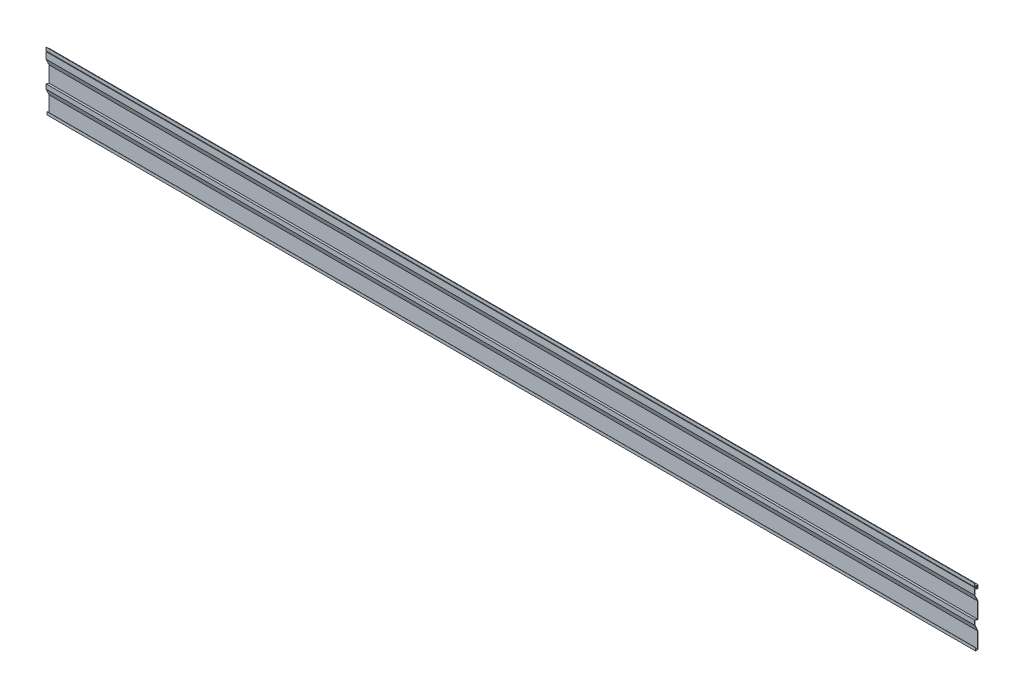
from build123d import *

# Parameters (mm, degrees)
EXTRUDE_1_DEPTH = 3660


with BuildPart() as part:
    # Эскиз1 → Бобышка-Вытянуть1 (new body)
    with BuildSketch(Plane(origin=(0, 0, 0), x_dir=(0, 0, -1), z_dir=(1, 0, 0))):
        Polygon((-21.04046283, -176.74277017), (-11.04046283, -176.74277017), (-11.04046283, -112.74277017), (-23.447393592, -86.746885797), (-23.447393592, -71.14960141), (-11.04046283, -74.694438771), (-11.04046283, -10.694438771), (-23.447393592, 15.301445602), (-23.447393592, 40.305561229), (-17.243928211, 40.305561229), (-17.243928211, 32.005165785), (-11.04046283, 32.005165785), (-11.04046283, 45.121064019), (-23.447393592, 45.121064019), (-23.447393592, 56.305561229), (-24.507119661, 56.305561229), (-24.507119661, 43.820437884), (-12.100188898, 43.820437884), (-12.100188898, 33.361087922), (-16.2229249, 33.361087922), (-16.2229249, 41.232557481), (-24.507119661, 41.232557481), (-24.507119661, 15.301445602), (-12.100188898, -10.694438771), (-12.100188898, -72.620716315), (-24.507119661, -69.075878954), (-24.507119661, -86.746885797), (-12.100188898, -112.74277017), (-12.100188898, -175.263961293), (-20.345660902, -175.263961293), (-20.345660902, -165.442275203), (-21.04046283, -165.442275203), align=None)
    extrude(amount=EXTRUDE_1_DEPTH)


solid = part.part
